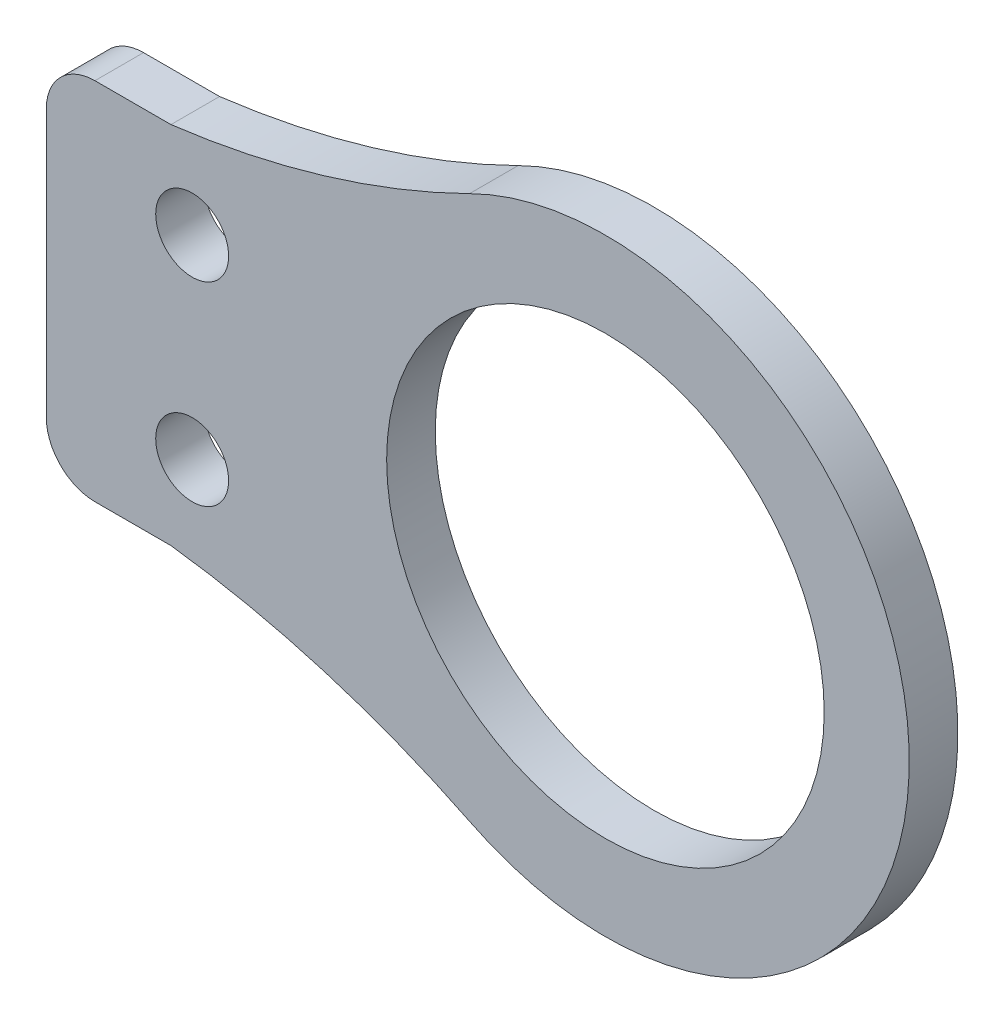
from build123d import *
from build123d.topology import SkipClean

# Parameters (mm, degrees)
SKETCH_1_R      = 12.5
SKETCH_1_R_2    = 9
EXTRUDE_1_DEPTH = 1
SKETCH_2_R      = 1.5
EXTRUDE_2_DEPTH = 1
EXTRUDE_START   = 1
SKETCH_3_R      = 1.5
SKETCH_3_R_2    = 9
EXTRUDE_3_DEPTH = 1
FILLET_2_R      = 2


with BuildPart() as part:
    # 草图1 → 凸台-拉伸1 (new body)
    with BuildSketch(Plane.XY):
        Circle(SKETCH_1_R)
        Circle(SKETCH_1_R_2, mode=Mode.SUBTRACT)
    extrude(amount=EXTRUDE_1_DEPTH)

    # 草图2 → 凸台-拉伸2 (add)
    with BuildSketch(Plane(origin=(0, 0, 0), x_dir=(-1, 0, 0), z_dir=(0, 0, -1))):
        with BuildLine():
            Line((23, 7.5), (17.872431242, 7.5))
            ThreePointArc((17.872431242, 7.5), (11.57716844, 8.82453246), (5.590816153, 11.180016759))
            ThreePointArc((5.590816153, 11.180016759), (10.633325019, 6.571331603), (12.5, 0))
            ThreePointArc((12.5, 0), (10.633325019, -6.571331603), (5.590816153, -11.180016759))
            ThreePointArc((5.590816153, -11.180016759), (11.57716844, -8.82453246), (17.872431242, -7.5))
            Line((17.872431242, -7.5), (23, -7.5))
            Line((23, -7.5), (23, 7.5))
        make_face()
        with Locations((17, -4)):
            Circle(SKETCH_2_R, mode=Mode.SUBTRACT)
        with Locations((17, 4)):
            Circle(SKETCH_2_R, mode=Mode.SUBTRACT)
    extrude(amount=-EXTRUDE_2_DEPTH)

    # 草图3 → 凸台-拉伸3 (add)
    with SkipClean():  # the faces are left unmerged after this step: merging them gives an invalid solid
        with BuildSketch(Plane(origin=(0, 0, 0), x_dir=(-1, 0, 0), z_dir=(0, 0, -1)).offset(EXTRUDE_START)):
            with BuildLine():
                Line((23, -7.5), (23, 7.5))
                Line((23, 7.5), (17.872431242, 7.5))
                ThreePointArc((17.872431242, 7.5), (11.57716844, 8.82453246), (5.590816153, 11.180016759))
                ThreePointArc((5.590816153, 11.180016759), (-12.5, 0), (5.590816153, -11.180016759))
                ThreePointArc((5.590816153, -11.180016759), (11.57716844, -8.82453246), (17.872431242, -7.5))
                Line((17.872431242, -7.5), (23, -7.5))
            make_face()
            with Locations((17, -4)):
                Circle(SKETCH_3_R, mode=Mode.SUBTRACT)
            with Locations((17, 4)):
                Circle(SKETCH_3_R, mode=Mode.SUBTRACT)
            Circle(SKETCH_3_R_2, mode=Mode.SUBTRACT)
        extrude(amount=-EXTRUDE_3_DEPTH)

    # 圆角2
    fillet_2_edges = [part.edges().sort_by_distance(p)[0] for p in [
        (-23, 7.5, 0.5),
        (-23, -7.5, 0.5),
    ]]
    fillet(fillet_2_edges, radius=FILLET_2_R)


solid = part.part
